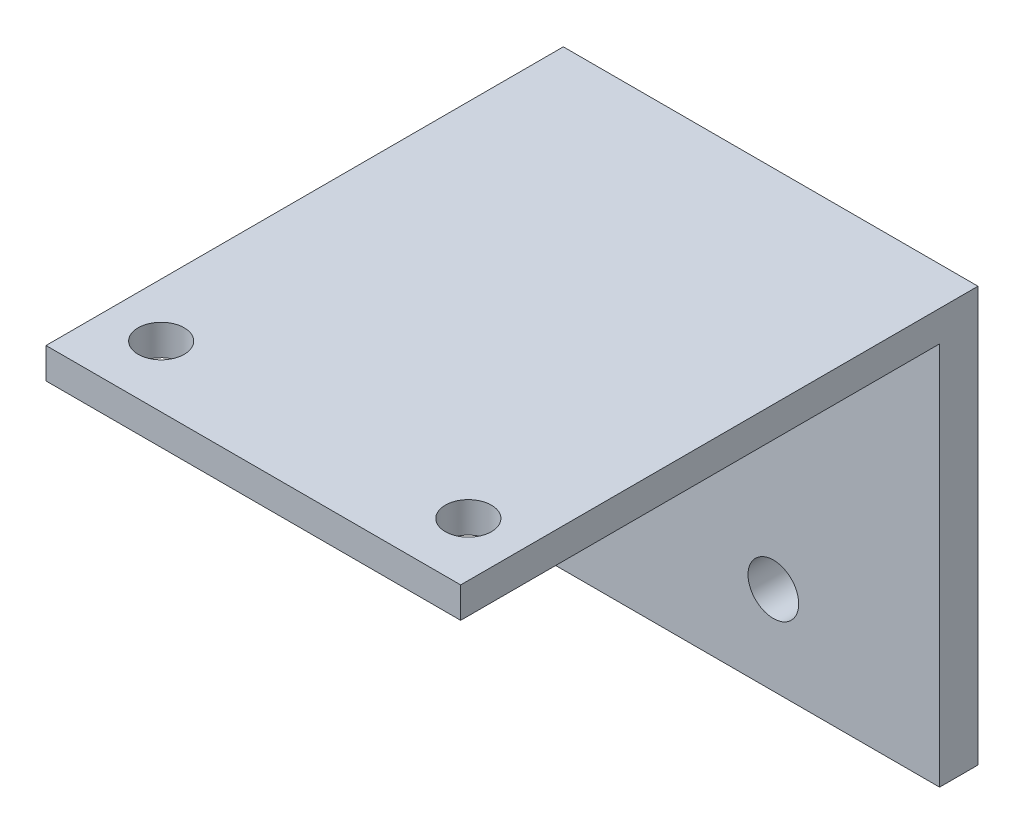
from build123d import *

# Parameters (mm, degrees)
ESQUISSE1_W             = 54
ESQUISSE1_H             = 54
BOSS_EXTRU_1_DEPTH      = 67.37
ESQUISSE2_W             = 85.887974464
ESQUISSE2_H             = 58.790343592
ENL_V_MAT_EXTRU_1_DEPTH = 62.37
ESQUISSE3_R             = 3
ENL_V_MAT_EXTRU_2_DEPTH = 62.37
D_GAGEMENT_M61_D        = 6.6


with BuildPart() as part:
    # Esquisse1 → Boss.-Extru.1 (new body)
    with BuildSketch(Plane.XY):
        Rectangle(ESQUISSE1_W, ESQUISSE1_H)
    extrude(amount=BOSS_EXTRU_1_DEPTH)

    # Esquisse2 → Enlèv. mat.-Extru.1 (cut)
    with BuildSketch(Plane.XY.offset(67.37)):
        with Locations((-4.168944697, -6.395171796)):
            Rectangle(ESQUISSE2_W, ESQUISSE2_H)
    extrude(amount=-ENL_V_MAT_EXTRU_1_DEPTH, mode=Mode.SUBTRACT)

    # Esquisse3 → Enlèv. mat.-Extru.2 (cut)
    with BuildSketch(Plane.XZ.offset(-23)):
        with Locations(Location((-20, 59.37, 0), (0, 0, 270))):
            Circle(ESQUISSE3_R)
        with Locations(Location((20, 59.37, 0), (0, 0, 270))):
            Circle(ESQUISSE3_R)
    extrude(amount=-ENL_V_MAT_EXTRU_2_DEPTH, mode=Mode.SUBTRACT)

    # Dégagement M61 (through all)
    with Locations(Plane(origin=(0, 0, 0), x_dir=(-1, 0, 0), z_dir=(0, 0, -1))):
        with Locations((-5.352283833, -15.5), (-5.352283833, 16.5)):
            Hole(D_GAGEMENT_M61_D / 2)


solid = part.part
